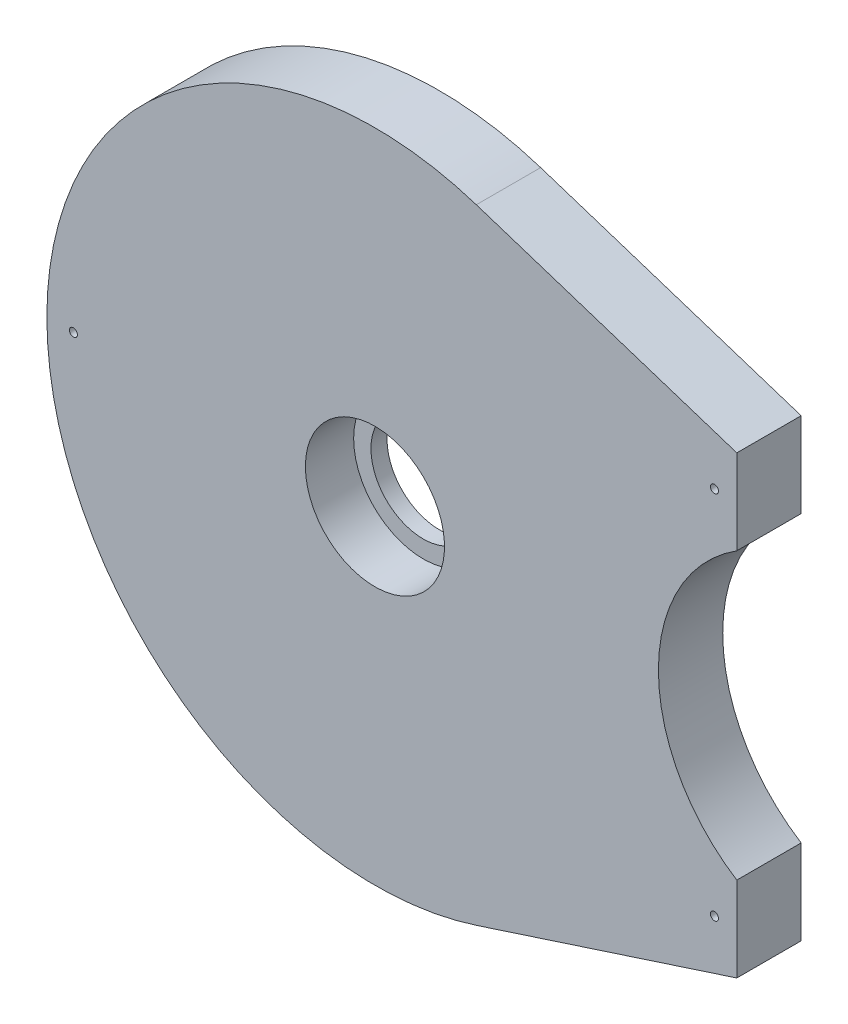
from build123d import *

# Parameters (mm, degrees)
SKETCH_1_R          = 40.8
EXTRUDE_1_DEPTH     = 4
SKETCH_3_R          = 3.15
CUT_EXTRUDE_1_DEPTH = 10
EXTRUDE_START       = -8
EXTRUDE_3_DEPTH     = 8
SKETCH_6_R          = 21
CUT_EXTRUDE_2_DEPTH = 10
SKETCH_7_R          = 0.5
CUT_EXTRUDE_3_DEPTH = 10


with BuildPart() as part:
    # 草图1 → 凸台-拉伸1 (new, symmetric)
    with BuildSketch(Plane.XY):
        Circle(SKETCH_1_R)
    extrude(amount=EXTRUDE_1_DEPTH, both=True)

    # 草图2 → 切除-旋转2 (revolve, cut)
    with BuildSketch(Plane(origin=(0, 0, 0), x_dir=(1, 0, 0), z_dir=(0, 1, 0)), mode=Mode.PRIVATE) as cut_revolve_2_sk:
        Polygon((0, 4), (0, -4), (8.65, -4), (8.65, 2), (6.5, 2), (6.5, 4), align=None)
    revolve(cut_revolve_2_sk.sketch.rotate(Axis((0, 0, -4), (0, 0, 1)), 180), axis=Axis((0, 0, -4), (0, 0, 1)), mode=Mode.SUBTRACT)

    # 草图3 → 切除-旋转3 (revolve, cut)
    with BuildSketch(Plane(origin=(0, 0, 0), x_dir=(1, 0, 0), z_dir=(0, 1, 0))):
        with Locations((31, 5)):
            Circle(SKETCH_3_R)
    revolve(axis=Axis((0, 0, 0), (0, 0, -1)), mode=Mode.SUBTRACT)

    # 草图4 → 切除-拉伸1 (cut)
    with BuildSketch(Plane(origin=(0, 0, -4), x_dir=(-1, 0, 0), z_dir=(0, 0, -1))):
        Polygon((-36, 19.2), (-36, -19.2), (-40.8, -19.2), (-40.8, 0), (-40.8, 19.2), align=None)
    extrude(amount=-CUT_EXTRUDE_1_DEPTH, mode=Mode.SUBTRACT)

    # 草图5 → 凸台-拉伸3 (add)
    with BuildSketch(Plane(origin=(0, 0, -4), x_dir=(-1, 0, 0), z_dir=(0, 0, -1)).offset(EXTRUDE_START)):
        with BuildLine():
            Line((-12.60789337, 38.803105865), (-45, 28.278272418))
            Line((-45, 28.278272418), (-45, -28.278272418))
            Line((-45, -28.278272418), (-12.60789337, -38.803105865))
            ThreePointArc((-12.60789337, -38.803105865), (-24.80809717, -32.391330859), (-34.177392951, -22.283307903))
            Line((-34.177392951, -22.283307903), (-34.876380269, 21.172578948))
            ThreePointArc((-34.876380269, 21.172578948), (-25.32583524, 31.988155142), (-12.60789337, 38.803105865))
        make_face()
    extrude(amount=EXTRUDE_3_DEPTH)

    # 草图6 → 切除-拉伸2 (cut)
    with BuildSketch(Plane(origin=(0, 0, -4), x_dir=(-1, 0, 0), z_dir=(0, 0, -1))):
        with Locations((-56.25, 0)):
            Circle(SKETCH_6_R)
    extrude(amount=-CUT_EXTRUDE_2_DEPTH, mode=Mode.SUBTRACT)

    # 草图7 → 切除-拉伸3 (cut)
    with BuildSketch(Plane(origin=(0, 0, -4), x_dir=(-1, 0, 0), z_dir=(0, 0, -1))):
        with Locations((-42.219558781, 23.005329022)):
            Circle(SKETCH_7_R)
        with Locations((-42.219558781, -23.005329022)):
            Circle(SKETCH_7_R)
        with Locations((37.5, 0)):
            Circle(SKETCH_7_R)
    extrude(amount=-CUT_EXTRUDE_3_DEPTH, mode=Mode.SUBTRACT)


solid = part.part
